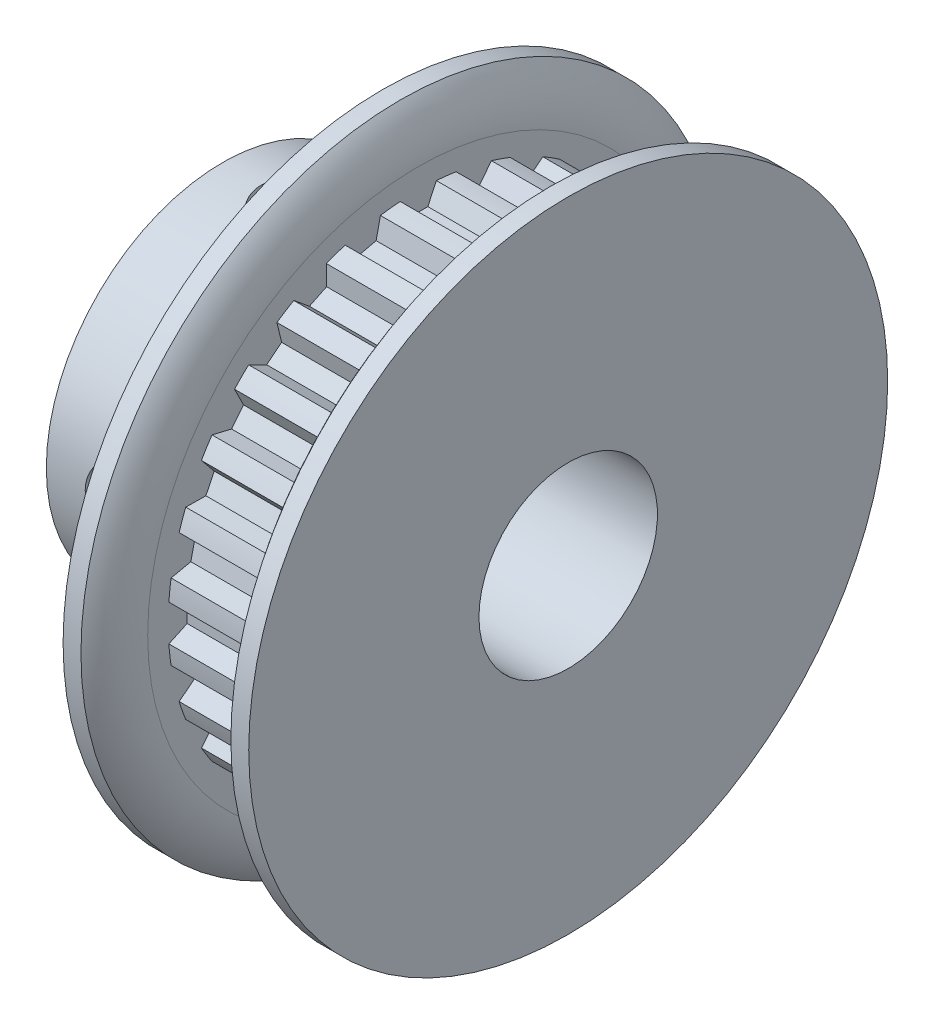
from build123d import *

# Parameters (mm, degrees)
SKETCH4_R          = 9.0551
SKETCH4_R_2        = 8.89635
CUT_EXTRUDE2_DEPTH = 4.064
CUT_EXTRUDE1_DEPTH = 4.064
CIRPATTERN1_COUNT  = 28
SKETCH6_R          = 1.4605
CUT_EXTRUDE3_DEPTH = 18.209816813
CUT_EXTRUDE4_DEPTH = 1.016
CIRPATTERN2_COUNT  = 2
CIRPATTERN2_ANGLE  = 90
CIRPATTERN3_COUNT  = 2
CIRPATTERN3_ANGLE  = 90


with BuildPart() as part:
    # Sketch1 → Revolve1 (revolve)
    with BuildSketch(Plane.XY, mode=Mode.PRIVATE) as revolve1_sk:
        with BuildLine():
            Line((-6.1468, 3.175), (6.1468, 3.175))
            Line((6.1468, 3.175), (6.1468, 11.3665))
            Line((6.1468, 11.3665), (5.5118, 11.3665))
            ThreePointArc((5.5118, 11.3665), (5.040511069, 10.552677347), (4.8768, 9.6266))
            Line((4.8768, 9.6266), (4.8768, 9.0551))
            Line((4.8768, 9.0551), (0.8128, 9.0551))
            Line((0.8128, 9.0551), (0.8128, 9.6266))
            ThreePointArc((0.8128, 9.6266), (0.649088931, 10.552677347), (0.1778, 11.3665))
            Line((0.1778, 11.3665), (-0.4572, 11.3665))
            Line((-0.4572, 11.3665), (-0.4572, 6.2738))
            Line((-0.4572, 6.2738), (-6.1468, 6.2738))
            Line((-6.1468, 6.2738), (-6.1468, 3.175))
        make_face()
    revolve(revolve1_sk.sketch.rotate(Axis((-6.1468, 0, 0), (1, 0, 0)), 90), axis=Axis((-6.1468, 0, 0), (1, 0, 0)))

    # Sketch4 → Cut-Extrude2 (cut)
    with BuildSketch(Plane(origin=(0.8128, 0, 0), x_dir=(0, 0, -1), z_dir=(1, 0, 0))):
        Circle(SKETCH4_R)
        Circle(SKETCH4_R_2, mode=Mode.SUBTRACT)
    extrude(amount=CUT_EXTRUDE2_DEPTH, mode=Mode.SUBTRACT)

    # Sketch3 → Cut-Extrude1 (cut)
    with BuildSketch(Plane(origin=(0.8128, 0, 0), x_dir=(0, 0, -1), z_dir=(1, 0, 0))):
        with BuildLine():
            Line((-0.643388094, 8.873054439), (-0.340062676, 8.222570981))
            Line((-0.340062676, 8.222570981), (0.340062676, 8.222570981))
            Line((0.340062676, 8.222570981), (0.643388094, 8.873054439))
            ThreePointArc((0.643388094, 8.873054439), (0, 8.89635), (-0.643388094, 8.873054439))
        make_face()
    cut_extrude1 = extrude(amount=CUT_EXTRUDE1_DEPTH, mode=Mode.SUBTRACT)

    # CirPattern1: Cut-Extrude1 ×28 about axis
    cirpattern1_axis = Axis((0, 0, 0), (1, 0, 0))
    for i in range(1, CIRPATTERN1_COUNT):
        add(cut_extrude1.rotate(cirpattern1_axis, i * 360 / CIRPATTERN1_COUNT), mode=Mode.SUBTRACT)

    # Sketch6 → Cut-Extrude3 (cut, through all)
    with BuildSketch(Plane(origin=(0, 0, 0), x_dir=(1, 0, 0), z_dir=(0, 1, 0))):
        with Locations(Location((-3.302, 0, 0), (0, 0, 90))):
            Circle(SKETCH6_R)
    cut_extrude3 = extrude(amount=CUT_EXTRUDE3_DEPTH, mode=Mode.SUBTRACT)

    # CirPattern2: Cut-Extrude3 ×2 about axis
    cirpattern2_axis = Axis((-6.1468, 0, 0), (1, 0, 0))
    for i in range(1, CIRPATTERN2_COUNT):
        add(cut_extrude3.rotate(cirpattern2_axis, i * CIRPATTERN2_ANGLE / (CIRPATTERN2_COUNT - 1)), mode=Mode.SUBTRACT)


with BuildPart() as body_2:
    # Sketch7 → Revolve2 (revolve)
    with BuildSketch(Plane.XY, mode=Mode.PRIVATE) as revolve2_sk:
        Polygon((-4.4704, 6.2738), (-3.302, 6.2738), (-3.302, 3.556), (-4.4704, 3.556), (-4.7244, 3.81), (-4.7244, 6.0198), align=None)
    revolve(revolve2_sk.sketch.rotate(Axis((-3.302, 3.556, 0), (0, 1, 0)), 270), axis=Axis((-3.302, 3.556, 0), (0, 1, 0)))

    # Sketch8 → Cut-Extrude4 (cut)
    with BuildSketch(Plane(origin=(0, 6.2738, 0), x_dir=(1, 0, 0), z_dir=(0, 1, 0))):
        Polygon((-3.302, 0.821223023), (-4.0132, 0.410611511), (-4.0132, -0.410611511), (-3.302, -0.821223023), (-2.5908, -0.410611511), (-2.5908, 0.410611511), align=None)
    extrude(amount=-CUT_EXTRUDE4_DEPTH, mode=Mode.SUBTRACT)


with BuildPart() as cirpattern3_1:
    # CirPattern3: pattern copy
    add(body_2.part.rotate(Axis((0, 0, 0), (1, 0, 0)), 1 * CIRPATTERN3_ANGLE / (CIRPATTERN3_COUNT - 1)))


solid = Compound([part.part, body_2.part, cirpattern3_1.part])
